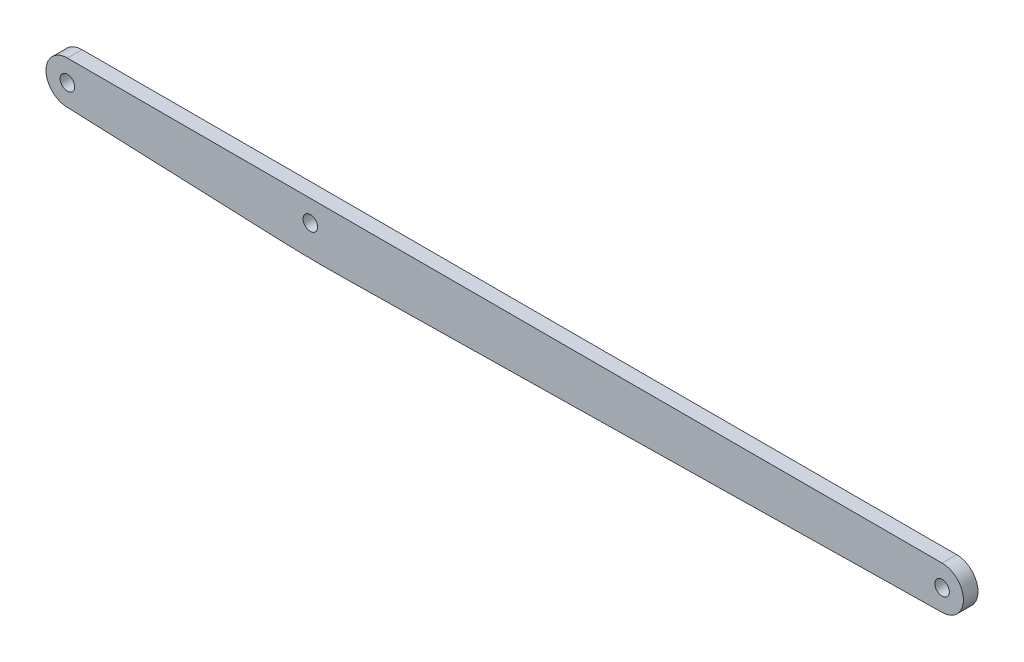
from build123d import *

# Parameters (mm, degrees)
SKETCH1_R           = 3
BOSS_EXTRUDE1_DEPTH = 6
SCALE1_SCALE        = 0.5


with BuildPart() as part:
    # Sketch1 → Boss-Extrude1 (new body)
    with BuildSketch(Plane.XY):
        with BuildLine():
            Line((-180, 8.791952491), (180, 8.791952491))
            ThreePointArc((180, 8.791952491), (188.791952491, 0), (180, -8.791952491))
            Line((180, -8.791952491), (-65.874044075, -12.652154123))
            ThreePointArc((-65.874044075, -12.652154123), (-79.997495837, -12.674394151), (-94.115941273, -12.297720824))
            Line((-94.115941273, -12.297720824), (-180, -8.791952491))
            ThreePointArc((-180, -8.791952491), (-188.791952491, 0), (-180, 8.791952491))
        make_face()
        with Locations((-180, 0)):
            Circle(SKETCH1_R, mode=Mode.SUBTRACT)
        with Locations((-80, 0)):
            Circle(SKETCH1_R, mode=Mode.SUBTRACT)
        with Locations((180, 0)):
            Circle(SKETCH1_R, mode=Mode.SUBTRACT)
    extrude(amount=-BOSS_EXTRUDE1_DEPTH)


with BuildPart() as part_1:
    # Scale1: scaled about (-2.379309964, -1.029732749, -3)
    add(part.part.scale(SCALE1_SCALE).moved(Location((-1.189654982, -0.514866374, -1.5))))


solid = part_1.part
